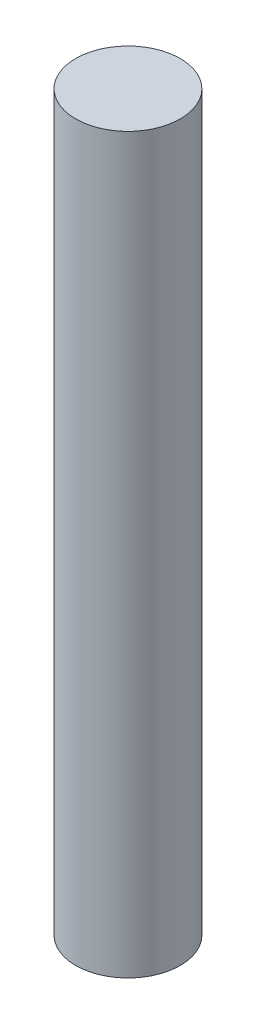
from build123d import *

# Parameters (mm, degrees)
SKETCH1_R           = 4.85
BOSS_EXTRUDE1_DEPTH = 34


with BuildPart() as part:
    # Sketch1 → Boss-Extrude1 (new, symmetric)
    with BuildSketch(Plane(origin=(0, 0, 0), x_dir=(1, 0, 0), z_dir=(0, 1, 0))):
        with Locations(Location((0, 0, 0), (0, 0, 270))):
            Circle(SKETCH1_R)
    extrude(amount=BOSS_EXTRUDE1_DEPTH, both=True)


solid = part.part
